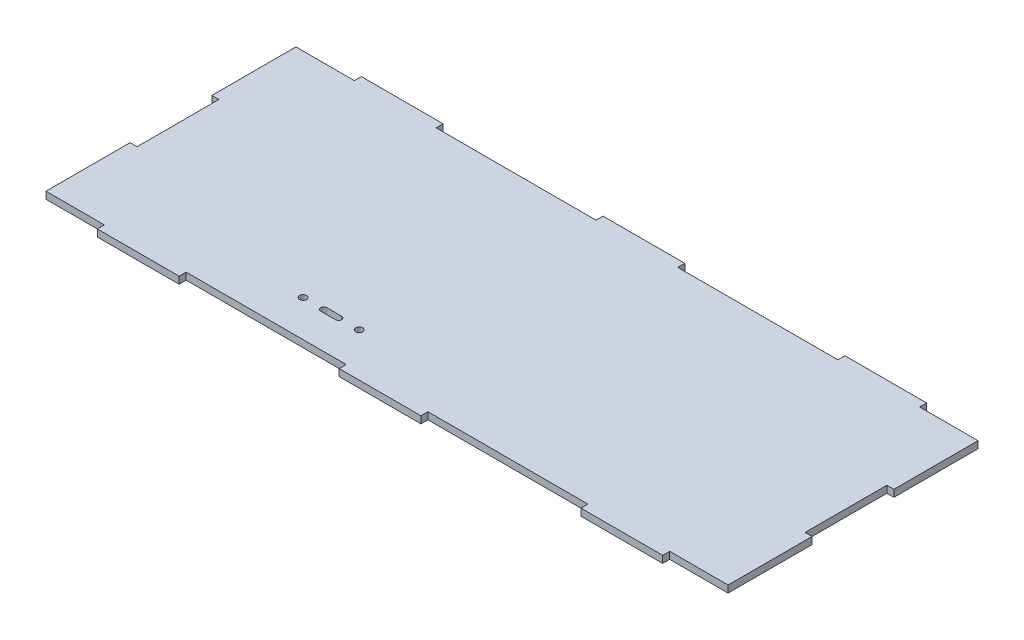
from build123d import *

# Parameters (mm, degrees)
SKETCH1_W           = 292
SKETCH1_H           = 107
BOSS_EXTRUDE1_DEPTH = 3
SKETCH8_W           = 3
SKETCH8_H           = 35
CUT_EXTRUDE7_DEPTH  = 3
SKETCH7_W           = 35
SKETCH7_H           = 3
BOSS_EXTRUDE2_DEPTH = 3
SKETCH4_W           = 35
SKETCH4_H           = 3
BOSS_EXTRUDE3_DEPTH = 3
SKETCH9_R           = 1.5
CUT_EXTRUDE8_DEPTH  = 10


with BuildPart() as part:
    # Sketch1 → Boss-Extrude1 (new body)
    with BuildSketch(Plane(origin=(0, 0, 0), x_dir=(1, 0, 0), z_dir=(0, 1, 0))):
        Rectangle(SKETCH1_W, SKETCH1_H)
    extrude(amount=BOSS_EXTRUDE1_DEPTH)

    # Sketch8 → Cut-Extrude7 (cut)
    with BuildSketch(Plane(origin=(0, 3, 0), x_dir=(1, 0, 0), z_dir=(0, 1, 0))):
        with Locations((144.5, 0)):
            Rectangle(SKETCH8_W, SKETCH8_H)
        with Locations((-144.5, 0)):
            Rectangle(SKETCH8_W, SKETCH8_H)
    extrude(amount=-CUT_EXTRUDE7_DEPTH, mode=Mode.SUBTRACT)

    # Sketch7 → Boss-Extrude2 (add)
    with BuildSketch(Plane(origin=(0, 3, 0), x_dir=(1, 0, 0), z_dir=(0, 1, 0))):
        with Locations((0, -55)):
            Rectangle(SKETCH7_W, SKETCH7_H)
        with Locations((0, 55)):
            Rectangle(SKETCH7_W, SKETCH7_H)
    extrude(amount=-BOSS_EXTRUDE2_DEPTH)

    # Sketch4 → Boss-Extrude3 (add)
    with BuildSketch(Plane(origin=(0, 3, 0), x_dir=(1, 0, 0), z_dir=(0, 1, 0))):
        with Locations((-103.5, -55)):
            Rectangle(SKETCH4_W, SKETCH4_H)
        with Locations((-103.5, 55)):
            Rectangle(SKETCH4_W, SKETCH4_H)
        with Locations((103.5, 55)):
            Rectangle(SKETCH4_W, SKETCH4_H)
        with Locations((103.5, -55)):
            Rectangle(SKETCH4_W, SKETCH4_H)
    extrude(amount=-BOSS_EXTRUDE3_DEPTH)

    # Sketch9 → Cut-Extrude8 (cut)
    with BuildSketch(Plane(origin=(0, 3, 0), x_dir=(1, 0, 0), z_dir=(0, 1, 0))):
        with Locations(Location((-27.565814615, -37.860553904, 0), (0, 0, 270))):
            Circle(SKETCH9_R)
        with Locations(Location((-51.565814615, -37.860553904, 0), (0, 0, 270))):
            Circle(SKETCH9_R)
        with BuildLine():
            Line((-42.765814615, -36.560553904), (-36.365814615, -36.560553904))
            ThreePointArc((-36.365814615, -36.560553904), (-35.065814615, -37.860553904), (-36.365814615, -39.160553904))
            Line((-36.365814615, -39.160553904), (-42.765814615, -39.160553904))
            ThreePointArc((-42.765814615, -39.160553904), (-44.065814615, -37.860553904), (-42.765814615, -36.560553904))
        make_face()
    extrude(amount=-CUT_EXTRUDE8_DEPTH, mode=Mode.SUBTRACT)


solid = part.part
